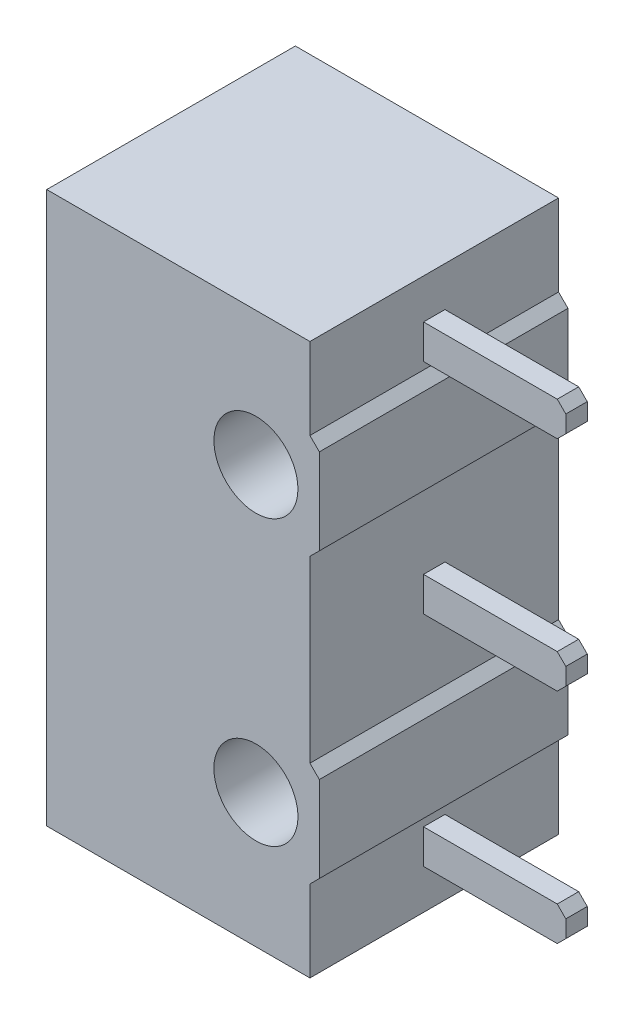
from build123d import *

# Parameters (mm, degrees)
SKETCH_1_R           = 0.98
EXTRUDE_1_DEPTH      = 5.8
SKETCH_2_W           = 0.5
SKETCH_2_H           = 0.8
EXTRUDE_2_DEPTH      = 3.32
CHAMFER_2_SIZE       = 0.2
EXTRUDE_3_DEPTH      = 1.38
EXTRUDE_3_DEPTH_BACK = 1.38
EXTRUDE_4_DEPTH      = 0.2
EXTRUDE_4_DEPTH_BACK = 0.2
SKETCH_4_R           = 0.25


with BuildPart() as part:
    # 草图1 → 凸台-拉伸1 (new body)
    with BuildSketch(Plane.XY):
        Polygon((0, 0), (6.14, 0), (6.14, 1.9), (6.36, 2.12), (6.36, 4.12), (6.14, 4.34), (6.14, 8.52), (6.36, 8.74), (6.36, 10.74), (6.14, 10.96), (6.14, 12.86), (0, 12.86), align=None)
        with Locations((4.88, 9.74)):
            Circle(SKETCH_1_R, mode=Mode.SUBTRACT)
        with Locations(Location((4.88, 3.12, 0), (0, 0, 180))):
            Circle(SKETCH_1_R, mode=Mode.SUBTRACT)
    extrude(amount=EXTRUDE_1_DEPTH)

    # 草图2 → 凸台-拉伸2 (add)
    with BuildSketch(Plane(origin=(6.14, 0, 0), x_dir=(0, 0, -1), z_dir=(1, 0, 0))):
        with Locations((-2.9, 11.53)):
            Rectangle(SKETCH_2_W, SKETCH_2_H)
        with Locations((-2.9, 1.33)):
            Rectangle(SKETCH_2_W, SKETCH_2_H)
        with Locations((-2.9, 6.43)):
            Rectangle(SKETCH_2_W, SKETCH_2_H)
    extrude(amount=EXTRUDE_2_DEPTH)

    # 倒角2
    chamfer_2_edges = [part.edges().sort_by_distance(p)[0] for p in [
        (9.46, 11.13, 2.9),
        (9.46, 11.93, 2.9),
        (9.46, 0.93, 2.9),
        (9.46, 1.73, 2.9),
        (9.46, 6.03, 2.9),
        (9.46, 6.83, 2.9),
    ]]
    chamfer(chamfer_2_edges, length=CHAMFER_2_SIZE)

    # 草图3 → 凸台-拉伸3 (add, two sides: drawn at the far end of the back side and taken through both)
    with BuildSketch(Plane.XY.offset(2.9).offset(-EXTRUDE_3_DEPTH_BACK)):
        with BuildLine():
            Line((0, 4.8), (-0.5, 4.8))
            ThreePointArc((-0.5, 4.8), (-1, 4.3), (-0.5, 3.8))
            Line((-0.5, 3.8), (0, 3.8))
            Line((0, 3.8), (0, 4.8))
        make_face()
    extrude(amount=EXTRUDE_3_DEPTH + EXTRUDE_3_DEPTH_BACK)

    # 草图4 → 凸台-拉伸4 (add, two sides: drawn at the far end of the back side and taken through both)
    with BuildSketch(Plane.XY.offset(2.9).offset(-EXTRUDE_4_DEPTH_BACK)):
        with Locations((0, 1.93)):
            Circle(SKETCH_4_R)
    extrude(amount=EXTRUDE_4_DEPTH + EXTRUDE_4_DEPTH_BACK)


solid = part.part
